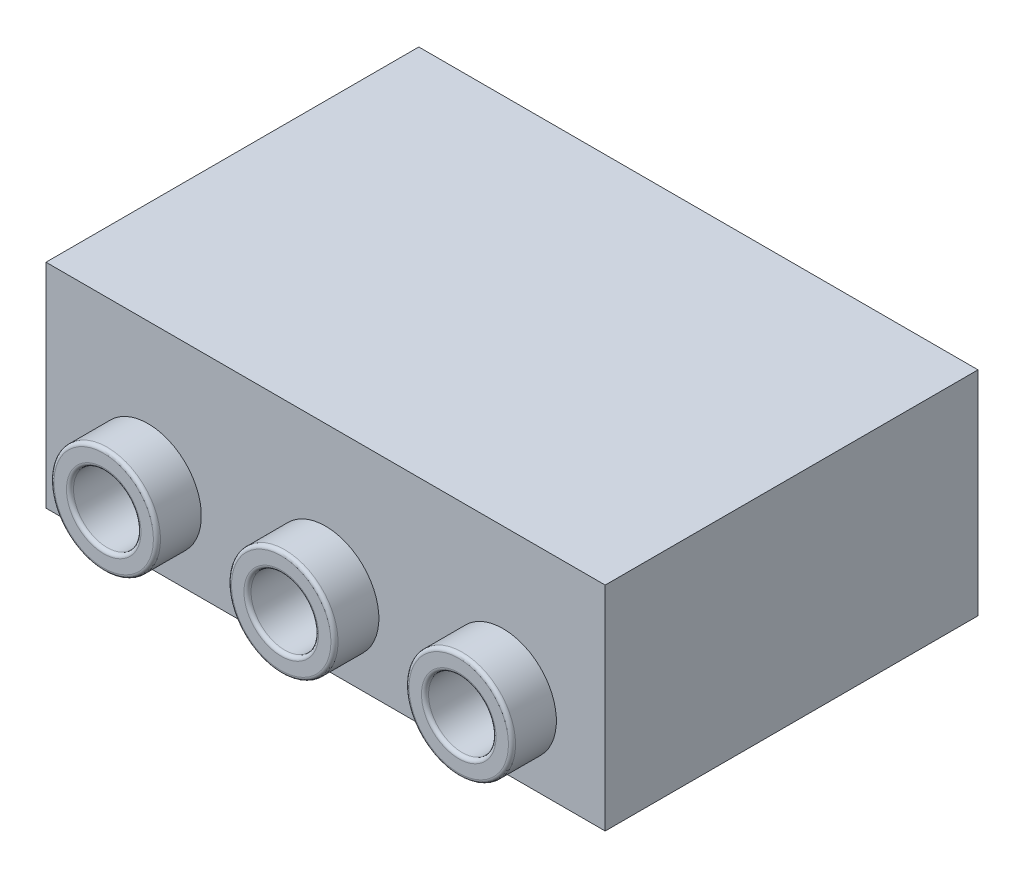
from build123d import *

# Parameters (mm, degrees)
SKETCH1_W           = 31.5
SKETCH1_H           = 21
BOSS_EXTRUDE1_DEPTH = 12
SKETCH2_R           = 3
SKETCH2_R_2         = 1.9
BOSS_EXTRUDE2_DEPTH = 2.5
FILLET1_R           = 0.2
CUT_EXTRUDE1_START  = -6
SKETCH3_R           = 1.9
CUT_EXTRUDE1_DEPTH  = 6


with BuildPart() as part:
    # Sketch1 → Boss-Extrude1 (new body)
    with BuildSketch(Plane(origin=(0, 0, 0), x_dir=(1, 0, 0), z_dir=(0, 1, 0))):
        Rectangle(SKETCH1_W, SKETCH1_H)
    extrude(amount=BOSS_EXTRUDE1_DEPTH)

    # Sketch2 → Boss-Extrude2 (add)
    # profile 1 of 3: a face of its own
    with BuildSketch(Plane.XY.offset(10.5)):
        with Locations(Location((0, 4, 0), (0, 0, 180))):
            Circle(SKETCH2_R)
        with Locations((0, 4)):
            Circle(SKETCH2_R_2, mode=Mode.SUBTRACT)
    # profile 2 of 3: a face of its own
    with BuildSketch(Plane.XY.offset(10.5)):
        with Locations(Location((10, 4, 0), (0, 0, 180))):
            Circle(SKETCH2_R)
        with Locations((10, 4)):
            Circle(SKETCH2_R_2, mode=Mode.SUBTRACT)
    # profile 3 of 3: a face of its own
    with BuildSketch(Plane.XY.offset(10.5)):
        with Locations(Location((-10, 4, 0), (0, 0, 180))):
            Circle(SKETCH2_R)
        with Locations((-10, 4)):
            Circle(SKETCH2_R_2, mode=Mode.SUBTRACT)
    extrude(amount=BOSS_EXTRUDE2_DEPTH)

    # Fillet1
    fillet1_edges = [part.edges().sort_by_distance(p)[0] for p in [
        (3, 4, 13),
        (-1.9, 4, 13),
        (13, 4, 13),
        (8.1, 4, 13),
        (-7, 4, 13),
        (-11.9, 4, 13),
    ]]
    fillet(fillet1_edges, radius=FILLET1_R)

    # Sketch3 → Cut-Extrude1 (cut)
    with BuildSketch(Plane.XY.offset(10.5).offset(CUT_EXTRUDE1_START)):
        with Locations((-10, 4)):
            Circle(SKETCH3_R)
        with Locations((0, 4)):
            Circle(SKETCH3_R)
        with Locations((10, 4)):
            Circle(SKETCH3_R)
    extrude(amount=CUT_EXTRUDE1_DEPTH, mode=Mode.SUBTRACT)


solid = part.part
